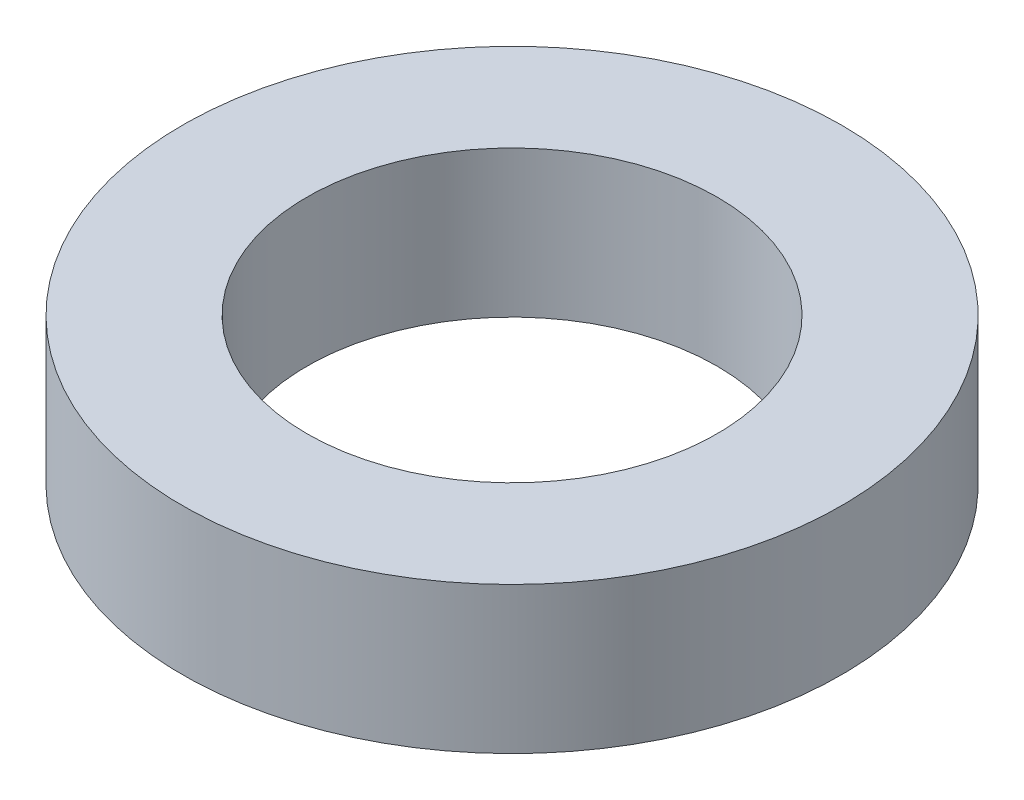
from build123d import *

# Parameters (mm, degrees)
SKETCH_1_W = 4.5
SKETCH_1_H = 2
SKETCH_2_R = 2.8
HOLE_DEPTH = 7.670832032


with BuildPart() as part:
    # 草图1 → Revolve 2 (revolve)
    with BuildSketch(Plane.XY, mode=Mode.PRIVATE) as revolve_2_sk:
        with Locations((2.25, 1)):
            Rectangle(SKETCH_1_W, SKETCH_1_H)
    revolve(revolve_2_sk.sketch.rotate(Axis((0, 0, 0), (0, 1, 0)), 90), axis=Axis((0, 0, 0), (0, 1, 0)))

    # 草图2 → Hole (cut, through all)
    with BuildSketch(Plane(origin=(0, 2, 0), x_dir=(1, 0, 0), z_dir=(0, 1, 0))):
        with Locations(Location((0, 0, 0), (0, 0, 270))):
            Circle(SKETCH_2_R)
    extrude(amount=-HOLE_DEPTH, mode=Mode.SUBTRACT)


solid = part.part
